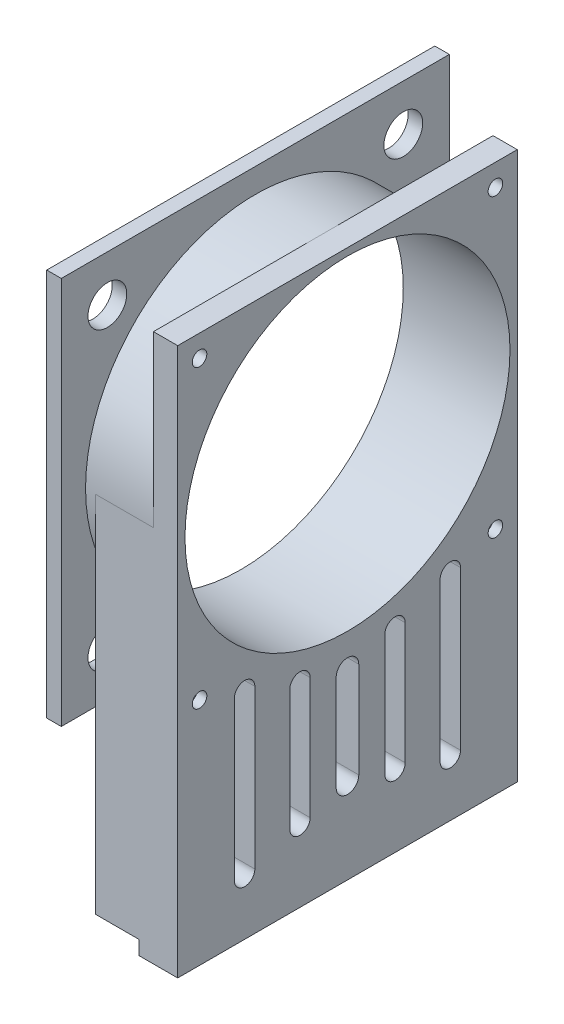
from build123d import *

# Parameters (mm, degrees)
SKETCH_1_R          = 35
SKETCH_1_R_2        = 33.5
EXTRUDE_1_DEPTH     = 22
EXTRUDE_START       = -17
EXTRUDE_2_DEPTH     = 17
EXTRUDE_START_2     = -5
EXTRUDE_3_DEPTH     = 5
SKETCH_9_W          = 17
SKETCH_9_H          = 70
EXTRUDE_4_DEPTH     = 5
SKETCH_10_W         = 8
SKETCH_10_H         = 70
EXTRUDE_5_DEPTH     = 2.9
SKETCH_12_W         = 80
SKETCH_12_H         = 80
SKETCH_12_R         = 35
EXTRUDE_7_DEPTH     = 3
SKETCH_3_R          = 1.5
CUT_EXTRUDE_1_DEPTH = 30
CUT_EXTRUDE_3_DEPTH = 15
CUT_EXTRUDE_4_DEPTH = 30
SKETCH_13_R         = 4
CUT_EXTRUDE_5_DEPTH = 3


with BuildPart() as part:
    # 草图1 → 凸台-拉伸1 (new body)
    with BuildSketch(Plane(origin=(0, 0, 0), x_dir=(0, 0, -1), z_dir=(1, 0, 0))):
        Circle(SKETCH_1_R)
        Circle(SKETCH_1_R_2, mode=Mode.SUBTRACT)
    extrude(amount=EXTRUDE_1_DEPTH)

    # 草图2 → 凸台-拉伸2 (add)
    with BuildSketch(Plane(origin=(22, 0, 0), x_dir=(0, 0, -1), z_dir=(1, 0, 0)).offset(EXTRUDE_START)):
        with BuildLine():
            Line((0, -70), (0, -35))
            ThreePointArc((0, -35), (-24.748737342, -24.748737342), (-35, 0))
            Line((-35, 0), (-35, -70))
            Line((-35, -70), (0, -70))
        make_face()
        with BuildLine():
            ThreePointArc((35, 0), (24.748737342, -24.748737342), (0, -35))
            Line((0, -35), (0, -70))
            Line((0, -70), (35, -70))
            Line((35, -70), (35, 0))
        make_face()
    extrude(amount=EXTRUDE_2_DEPTH)

    # 草图4 → 凸台-拉伸3 (add)
    with BuildSketch(Plane(origin=(22, 0, 0), x_dir=(0, 0, -1), z_dir=(1, 0, 0)).offset(EXTRUDE_START_2)):
        with BuildLine():
            Line((35, 35), (0, 35))
            ThreePointArc((0, 35), (24.748737342, 24.748737342), (35, 0))
            Line((35, 0), (35, 35))
        make_face()
        with BuildLine():
            Line((-35, 35), (-35, 0))
            ThreePointArc((-35, 0), (-24.748737342, 24.748737342), (0, 35))
            Line((0, 35), (-35, 35))
        make_face()
    extrude(amount=EXTRUDE_3_DEPTH)

    # 草图9 → 凸台-拉伸4 (add)
    with BuildSketch(Plane.XZ.offset(70)):
        with Locations((13.5, 0)):
            Rectangle(SKETCH_9_W, SKETCH_9_H)
    extrude(amount=EXTRUDE_4_DEPTH)

    # 草图10 → 凸台-拉伸5 (add)
    with BuildSketch(Plane.XZ.offset(75)):
        with Locations((18, 0)):
            Rectangle(SKETCH_10_W, SKETCH_10_H)
    extrude(amount=EXTRUDE_5_DEPTH)

    # 草图12 → 凸台-拉伸7 (add)
    with BuildSketch(Plane.ZY):
        Rectangle(SKETCH_12_W, SKETCH_12_H)
        Circle(SKETCH_12_R, mode=Mode.SUBTRACT)
    extrude(amount=-EXTRUDE_7_DEPTH)

    # 草图3 → 切除-拉伸1 (cut)
    with BuildSketch(Plane(origin=(22, 0, 0), x_dir=(0, 0, -1), z_dir=(1, 0, 0))):
        with BuildLine():
            Line((-30.5, -29), (-30.5, -30.5))
            Line((-30.5, -30.5), (-29, -30.5))
            ThreePointArc((-29, -30.5), (-29.439339828, -29.439339828), (-30.5, -29))
        make_face()
        with BuildLine():
            Line((-29, -30.5), (-30.5, -30.5))
            Line((-30.5, -30.5), (-30.5, -29))
            ThreePointArc((-30.5, -29), (-31.560660172, -31.560660172), (-29, -30.5))
        make_face()
        with BuildLine():
            ThreePointArc((30.5, -29), (29.439339828, -29.439339828), (29, -30.5))
            Line((29, -30.5), (30.5, -30.5))
            Line((30.5, -30.5), (30.5, -29))
        make_face()
        with BuildLine():
            Line((30.5, -30.5), (29, -30.5))
            ThreePointArc((29, -30.5), (30.5, -32), (32, -30.5))
            ThreePointArc((32, -30.5), (31.560660172, -29.439339828), (30.5, -29))
            Line((30.5, -29), (30.5, -30.5))
        make_face()
        with Locations((-30.5, 30.5)):
            Circle(SKETCH_3_R)
        with Locations((30.5, 30.5)):
            Circle(SKETCH_3_R)
    extrude(amount=-CUT_EXTRUDE_1_DEPTH, mode=Mode.SUBTRACT)

    # 草图7 → 切除-拉伸3 (cut)
    with BuildSketch(Plane.ZY.offset(-5)):
        with BuildLine():
            ThreePointArc((-27.25, -30.5), (-28.201902961, -28.201902961), (-30.5, -27.25))
            Line((-30.5, -27.25), (-30.5, -30.5))
            Line((-30.5, -30.5), (-27.25, -30.5))
        make_face()
        with BuildLine():
            Line((-30.5, -30.5), (-30.5, -27.25))
            ThreePointArc((-30.5, -27.25), (-32.798097039, -32.798097039), (-27.25, -30.5))
            Line((-27.25, -30.5), (-30.5, -30.5))
        make_face()
        with BuildLine():
            ThreePointArc((33.75, -30.5), (32.798097039, -28.201902961), (30.5, -27.25))
            Line((30.5, -27.25), (30.5, -30.5))
            Line((30.5, -30.5), (27.25, -30.5))
            ThreePointArc((27.25, -30.5), (30.5, -33.75), (33.75, -30.5))
        make_face()
        with BuildLine():
            Line((30.5, -30.5), (30.5, -27.25))
            ThreePointArc((30.5, -27.25), (28.201902961, -28.201902961), (27.25, -30.5))
            Line((27.25, -30.5), (30.5, -30.5))
        make_face()
    extrude(amount=-CUT_EXTRUDE_3_DEPTH, mode=Mode.SUBTRACT)

    # 草图8 → 切除-拉伸4 (cut)
    with BuildSketch(Plane(origin=(22, 0, 0), x_dir=(0, 0, -1), z_dir=(1, 0, 0))):
        with BuildLine():
            Line((-19.1, -66.389218309), (-19.1, -33.781302014))
            ThreePointArc((-19.1, -33.781302014), (-21.2, -31.681302014), (-23.3, -33.781302014))
            Line((-23.3, -33.781302014), (-23.3, -66.389218309))
            ThreePointArc((-23.3, -66.389218309), (-21.2, -68.489218309), (-19.1, -66.389218309))
        make_face()
        with BuildLine():
            Line((23.3, -66.389218309), (23.3, -33.781302014))
            ThreePointArc((23.3, -33.781302014), (21.2, -31.681302014), (19.1, -33.781302014))
            Line((19.1, -33.781302014), (19.1, -66.389218309))
            ThreePointArc((19.1, -66.389218309), (21.2, -68.489218309), (23.3, -66.389218309))
        make_face()
        with BuildLine():
            Line((-7.7, -62.920659131), (-7.7, -50.420659131))
            Line((-7.7, -50.420659131), (-7.7, -37.920659131))
            ThreePointArc((-7.7, -37.920659131), (-9.8, -35.820659131), (-11.9, -37.920659131))
            Line((-11.9, -37.920659131), (-11.9, -62.920659131))
            ThreePointArc((-11.9, -62.920659131), (-9.8, -65.020659131), (-7.7, -62.920659131))
        make_face()
        with BuildLine():
            Line((2.32685582, -60.300961988), (2.32685582, -40.540356273))
            ThreePointArc((2.32685582, -40.540356273), (0, -38.213500453), (-2.32685582, -40.540356273))
            Line((-2.32685582, -40.540356273), (-2.32685582, -60.300961988))
            ThreePointArc((-2.32685582, -60.300961988), (0, -62.627817808), (2.32685582, -60.300961988))
        make_face()
        with BuildLine():
            Line((11.9, -62.920659131), (11.9, -37.920659131))
            ThreePointArc((11.9, -37.920659131), (9.8, -35.820659131), (7.7, -37.920659131))
            Line((7.7, -37.920659131), (7.7, -50.420659131))
            Line((7.7, -50.420659131), (7.7, -62.920659131))
            ThreePointArc((7.7, -62.920659131), (9.8, -65.020659131), (11.9, -62.920659131))
        make_face()
    extrude(amount=-CUT_EXTRUDE_4_DEPTH, mode=Mode.SUBTRACT)

    # 草图13 → 切除-拉伸5 (cut)
    with BuildSketch(Plane.ZY):
        with Locations((-30.5, -30.5)):
            Circle(SKETCH_13_R)
        with Locations((30.5, -30.5)):
            Circle(SKETCH_13_R)
        with Locations((-30.5, 30.5)):
            Circle(SKETCH_13_R)
        with Locations((30.5, 30.5)):
            Circle(SKETCH_13_R)
    extrude(amount=-CUT_EXTRUDE_5_DEPTH, mode=Mode.SUBTRACT)


solid = part.part
